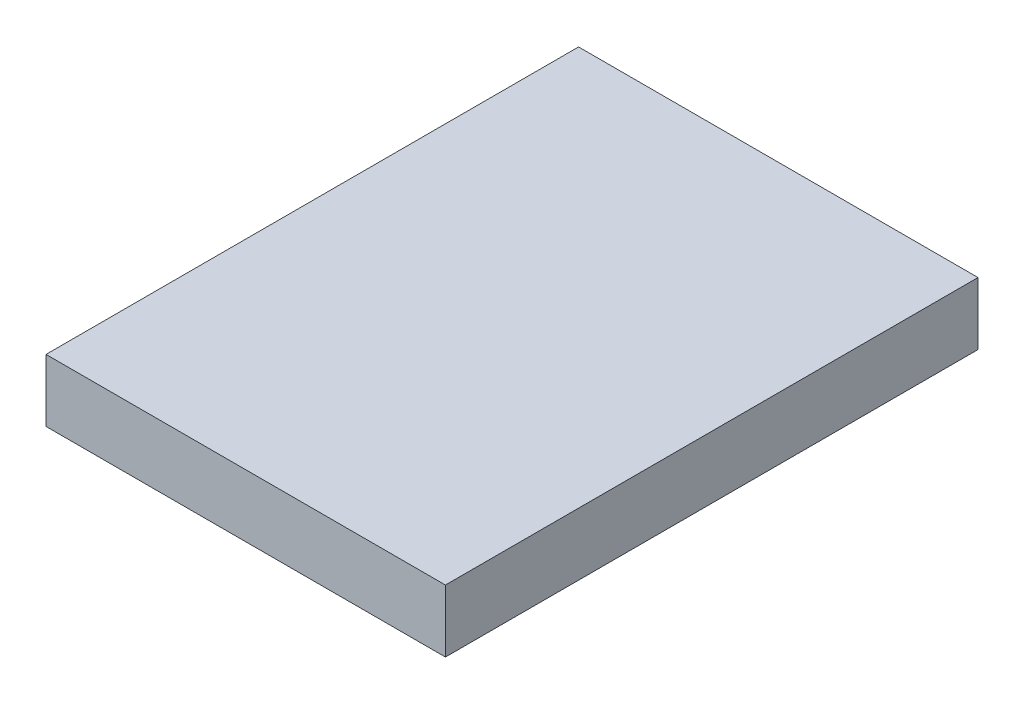
from build123d import *

# Parameters (mm, degrees)
SKETCH1_W           = 48
SKETCH1_H           = 64
BOSS_EXTRUDE1_DEPTH = 7.5


with BuildPart() as part:
    # Sketch1 → Boss-Extrude1 (new body)
    with BuildSketch(Plane(origin=(0, 0, 0), x_dir=(1, 0, 0), z_dir=(0, 1, 0))):
        Rectangle(SKETCH1_W, SKETCH1_H)
    extrude(amount=BOSS_EXTRUDE1_DEPTH)


solid = part.part
